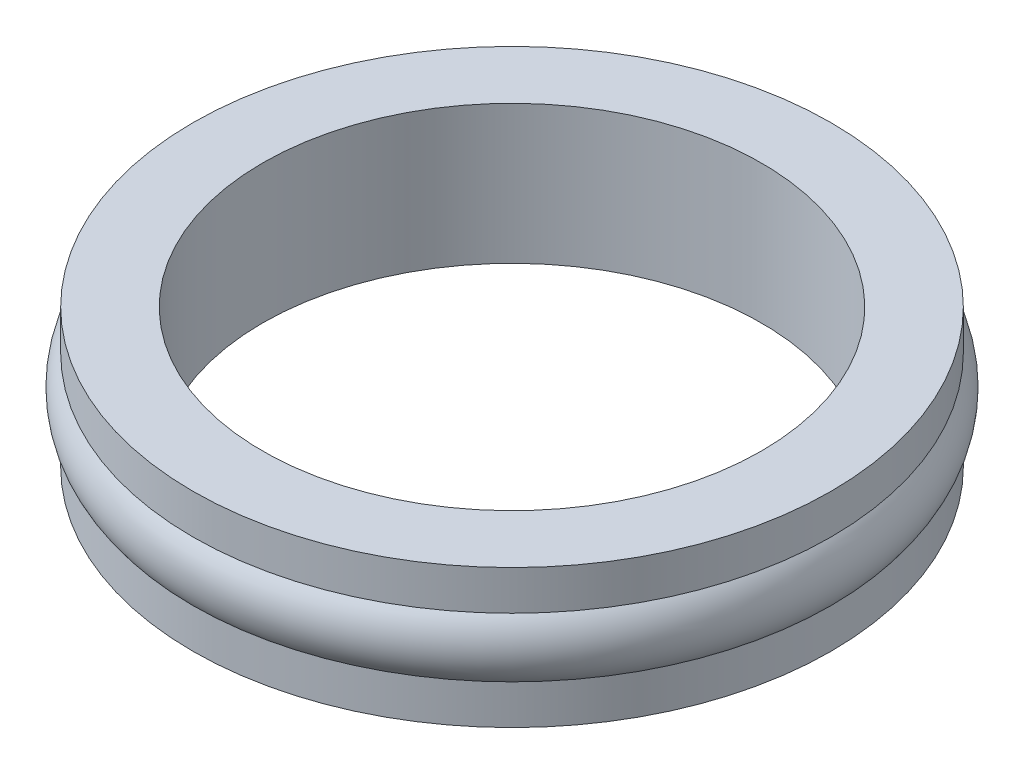
from build123d import *


with BuildPart() as part:
    # Sketch1 → Revolve1 (revolve)
    with BuildSketch(Plane.XY):
        with BuildLine():
            Line((8.06, -0.285743449), (8.06, -1.285743449))
            Line((8.06, -1.285743449), (6.3, -1.285743449))
            Line((6.3, -1.285743449), (6.3, 2.214256551))
            Line((6.3, 2.214256551), (8.06, 2.214256551))
            Line((8.06, 2.214256551), (8.06, 1.214256551))
            ThreePointArc((8.06, 1.214256551), (8.3232503, 0.464256551), (8.06, -0.285743449))
        make_face()
    revolve(axis=Axis((0, -133.995441592, 0), (0, 1, 0)))


solid = part.part
